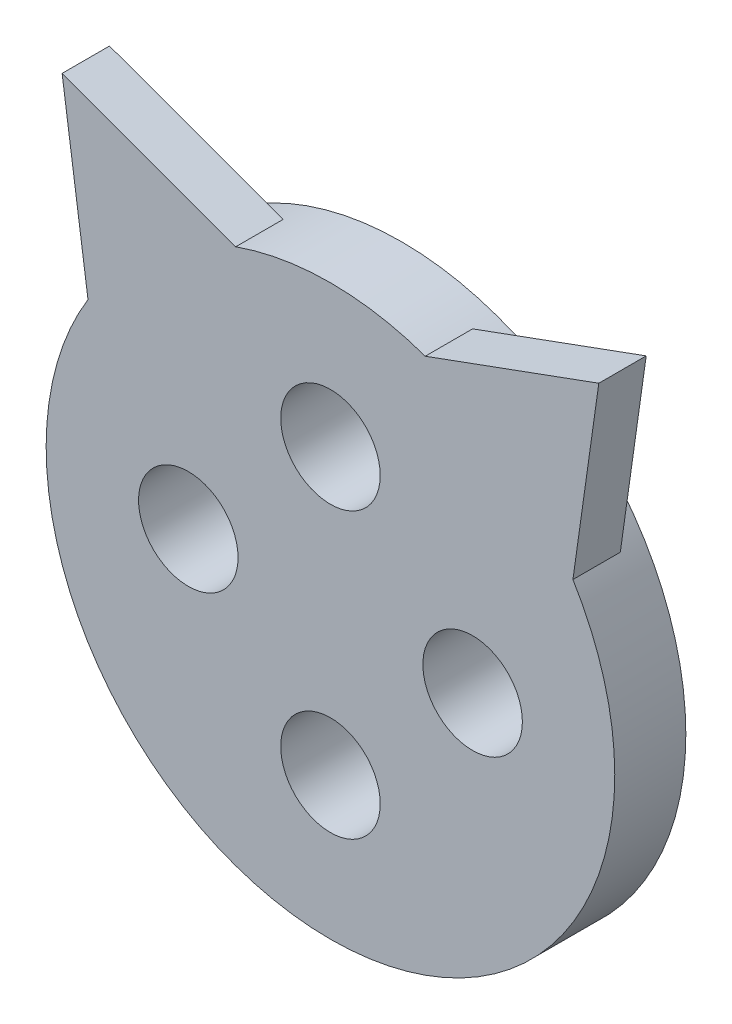
from build123d import *

# Parameters (mm, degrees)
SKETCH_1_R      = 12
SKETCH_1_R_2    = 2.1
EXTRUDE_1_DEPTH = 3
EXTRUDE_START   = -2
EXTRUDE_2_DEPTH = 2


with BuildPart() as part:
    # 草图1 → 凸台-拉伸1 (new body)
    with BuildSketch(Plane.XY):
        Circle(SKETCH_1_R)
        with Locations((0, 6)):
            Circle(SKETCH_1_R_2, mode=Mode.SUBTRACT)
        with Locations((6, 0)):
            Circle(SKETCH_1_R_2, mode=Mode.SUBTRACT)
        with Locations((0, -6)):
            Circle(SKETCH_1_R_2, mode=Mode.SUBTRACT)
        with Locations((-6, 0)):
            Circle(SKETCH_1_R_2, mode=Mode.SUBTRACT)
    extrude(amount=EXTRUDE_1_DEPTH)

    # 草图2 → 凸台-拉伸2 (add)
    with BuildSketch(Plane.XY.offset(3).offset(EXTRUDE_START)):
        with BuildLine():
            Line((-11.326666422, 13.989518497), (-10.233844137, 6.266453079))
            ThreePointArc((-10.233844137, 6.266453079), (-7.551110948, 9.326345664), (-4, 11.313708499))
            Line((-4, 11.313708499), (-11.326666422, 13.989518497))
        make_face()
        with BuildLine():
            Line((11.326666422, 13.989518497), (4, 11.313708499))
            ThreePointArc((4, 11.313708499), (7.551110948, 9.326345664), (10.233844137, 6.266453079))
            Line((10.233844137, 6.266453079), (11.326666422, 13.989518497))
        make_face()
    extrude(amount=EXTRUDE_2_DEPTH)


solid = part.part
